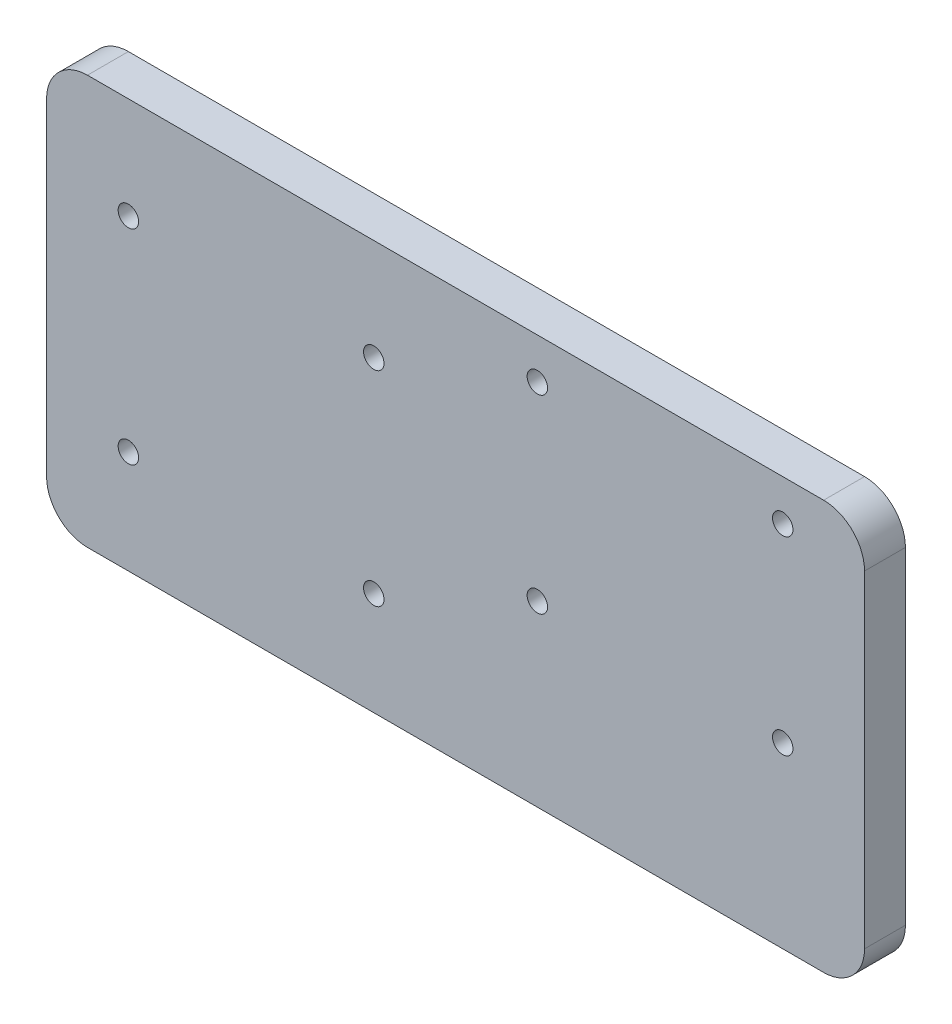
from build123d import *

# Parameters (mm, degrees)
SKETCH4_W                                     = 200
SKETCH4_H                                     = 100
BOSS_EXTRUDE1_DEPTH                           = 10
CBORE_FOR_M6_HEX_HEAD_CAP_SCREW7_D            = 6
CBORE_FOR_M6_HEX_HEAD_CAP_SCREW7_DEPTH        = 8
CBORE_FOR_M6_HEX_HEAD_CAP_SCREW7_CBORE_D      = 8
CBORE_FOR_M6_HEX_HEAD_CAP_SCREW7_CBORE_DEPTH  = 2
CBORE_FOR_M6_HEX_HEAD_CAP_SCREW7_TIP          = 1.802581857
CBORE_FOR_M6_HEX_HEAD_CAP_SCREW8_D            = 6
CBORE_FOR_M6_HEX_HEAD_CAP_SCREW8_DEPTH        = 8
CBORE_FOR_M6_HEX_HEAD_CAP_SCREW8_CBORE_D      = 8
CBORE_FOR_M6_HEX_HEAD_CAP_SCREW8_CBORE_DEPTH  = 2
CBORE_FOR_M6_HEX_HEAD_CAP_SCREW8_TIP          = 1.802581857
CBORE_FOR_M6_HEX_HEAD_CAP_SCREW9_D            = 6
CBORE_FOR_M6_HEX_HEAD_CAP_SCREW9_DEPTH        = 8
CBORE_FOR_M6_HEX_HEAD_CAP_SCREW9_CBORE_D      = 8
CBORE_FOR_M6_HEX_HEAD_CAP_SCREW9_CBORE_DEPTH  = 2
CBORE_FOR_M6_HEX_HEAD_CAP_SCREW9_TIP          = 1.802581857
CBORE_FOR_M6_HEX_HEAD_CAP_SCREW10_D           = 6
CBORE_FOR_M6_HEX_HEAD_CAP_SCREW10_DEPTH       = 8
CBORE_FOR_M6_HEX_HEAD_CAP_SCREW10_CBORE_D     = 8
CBORE_FOR_M6_HEX_HEAD_CAP_SCREW10_CBORE_DEPTH = 2
CBORE_FOR_M6_HEX_HEAD_CAP_SCREW10_TIP         = 1.802581857
F_1_0_1_DIAMETER_HOLE7_D                      = 5
F_1_0_1_DIAMETER_HOLE7_DEPTH                  = 8
F_1_0_1_DIAMETER_HOLE7_TIP                    = 1.502151548
F_1_0_1_DIAMETER_HOLE8_D                      = 5
F_1_0_1_DIAMETER_HOLE8_DEPTH                  = 8
F_1_0_1_DIAMETER_HOLE8_TIP                    = 1.502151548
F_1_0_1_DIAMETER_HOLE9_D                      = 5
F_1_0_1_DIAMETER_HOLE9_DEPTH                  = 8
F_1_0_1_DIAMETER_HOLE9_TIP                    = 1.502151548
F_1_0_1_DIAMETER_HOLE10_D                     = 5
F_1_0_1_DIAMETER_HOLE10_DEPTH                 = 8
F_1_0_1_DIAMETER_HOLE10_TIP                   = 1.502151548
F_5_0_5_DIAMETER_HOLE1_D                      = 5
F_5_0_5_DIAMETER_HOLE1_DEPTH                  = 8
F_5_0_5_DIAMETER_HOLE1_TIP                    = 1.502151548
F_5_0_5_DIAMETER_HOLE2_D                      = 5
F_5_0_5_DIAMETER_HOLE2_DEPTH                  = 8
F_5_0_5_DIAMETER_HOLE2_TIP                    = 1.502151548
F_5_0_5_DIAMETER_HOLE3_D                      = 5
F_5_0_5_DIAMETER_HOLE3_DEPTH                  = 8
F_5_0_5_DIAMETER_HOLE3_TIP                    = 1.502151548
F_5_0_5_DIAMETER_HOLE5_D                      = 5
F_5_0_5_DIAMETER_HOLE5_DEPTH                  = 8
F_5_0_5_DIAMETER_HOLE5_TIP                    = 1.502151548
FILLET1_R                                     = 10
FILLET2_R                                     = 10
FILLET3_R                                     = 10
FILLET4_R                                     = 10
SCALE2_SCALE                                  = 1.5
SCALE6_SCALE                                  = 0.935
SCALE7_SCALE                                  = 0.9


with BuildPart() as part:
    # Sketch4 → Boss-Extrude1 (new body)
    with BuildSketch(Plane.XY):
        with Locations((100, 50)):
            Rectangle(SKETCH4_W, SKETCH4_H)
    extrude(amount=BOSS_EXTRUDE1_DEPTH)

    # CBORE for M6 Hex Head Cap Screw7
    with Locations(Plane(origin=(0, 0, 0), x_dir=(-1, 0, 0), z_dir=(0, 0, -1))):
        with Locations((-80, 83.464013217)):
            CounterBoreHole(CBORE_FOR_M6_HEX_HEAD_CAP_SCREW7_D / 2, CBORE_FOR_M6_HEX_HEAD_CAP_SCREW7_CBORE_D / 2, CBORE_FOR_M6_HEX_HEAD_CAP_SCREW7_CBORE_DEPTH, depth=CBORE_FOR_M6_HEX_HEAD_CAP_SCREW7_DEPTH)
            with Locations((0, 0, -(CBORE_FOR_M6_HEX_HEAD_CAP_SCREW7_DEPTH + CBORE_FOR_M6_HEX_HEAD_CAP_SCREW7_TIP / 2))):  # 118° drill point
                Cone(0, CBORE_FOR_M6_HEX_HEAD_CAP_SCREW7_D / 2, CBORE_FOR_M6_HEX_HEAD_CAP_SCREW7_TIP, mode=Mode.SUBTRACT)

    # CBORE for M6 Hex Head Cap Screw8
    with Locations(Plane(origin=(0, 0, 0), x_dir=(-1, 0, 0), z_dir=(0, 0, -1))):
        with Locations((-20, 83.464013217)):
            CounterBoreHole(CBORE_FOR_M6_HEX_HEAD_CAP_SCREW8_D / 2, CBORE_FOR_M6_HEX_HEAD_CAP_SCREW8_CBORE_D / 2, CBORE_FOR_M6_HEX_HEAD_CAP_SCREW8_CBORE_DEPTH, depth=CBORE_FOR_M6_HEX_HEAD_CAP_SCREW8_DEPTH)
            with Locations((0, 0, -(CBORE_FOR_M6_HEX_HEAD_CAP_SCREW8_DEPTH + CBORE_FOR_M6_HEX_HEAD_CAP_SCREW8_TIP / 2))):  # 118° drill point
                Cone(0, CBORE_FOR_M6_HEX_HEAD_CAP_SCREW8_D / 2, CBORE_FOR_M6_HEX_HEAD_CAP_SCREW8_TIP, mode=Mode.SUBTRACT)

    # CBORE for M6 Hex Head Cap Screw9
    with Locations(Plane(origin=(0, 0, 0), x_dir=(-1, 0, 0), z_dir=(0, 0, -1))):
        with Locations((-20, 16.814013217)):
            CounterBoreHole(CBORE_FOR_M6_HEX_HEAD_CAP_SCREW9_D / 2, CBORE_FOR_M6_HEX_HEAD_CAP_SCREW9_CBORE_D / 2, CBORE_FOR_M6_HEX_HEAD_CAP_SCREW9_CBORE_DEPTH, depth=CBORE_FOR_M6_HEX_HEAD_CAP_SCREW9_DEPTH)
            with Locations((0, 0, -(CBORE_FOR_M6_HEX_HEAD_CAP_SCREW9_DEPTH + CBORE_FOR_M6_HEX_HEAD_CAP_SCREW9_TIP / 2))):  # 118° drill point
                Cone(0, CBORE_FOR_M6_HEX_HEAD_CAP_SCREW9_D / 2, CBORE_FOR_M6_HEX_HEAD_CAP_SCREW9_TIP, mode=Mode.SUBTRACT)

    # CBORE for M6 Hex Head Cap Screw10
    with Locations(Plane(origin=(0, 0, 0), x_dir=(-1, 0, 0), z_dir=(0, 0, -1))):
        with Locations((-80, 16.814013217)):
            CounterBoreHole(CBORE_FOR_M6_HEX_HEAD_CAP_SCREW10_D / 2, CBORE_FOR_M6_HEX_HEAD_CAP_SCREW10_CBORE_D / 2, CBORE_FOR_M6_HEX_HEAD_CAP_SCREW10_CBORE_DEPTH, depth=CBORE_FOR_M6_HEX_HEAD_CAP_SCREW10_DEPTH)
            with Locations((0, 0, -(CBORE_FOR_M6_HEX_HEAD_CAP_SCREW10_DEPTH + CBORE_FOR_M6_HEX_HEAD_CAP_SCREW10_TIP / 2))):  # 118° drill point
                Cone(0, CBORE_FOR_M6_HEX_HEAD_CAP_SCREW10_D / 2, CBORE_FOR_M6_HEX_HEAD_CAP_SCREW10_TIP, mode=Mode.SUBTRACT)

    # Ø1.0 (1) Diameter Hole7
    with Locations(Plane.XY.offset(10)):
        with Locations((20, 75.196019825)):
            Hole(F_1_0_1_DIAMETER_HOLE7_D / 2, depth=F_1_0_1_DIAMETER_HOLE7_DEPTH)
            with Locations((0, 0, -(F_1_0_1_DIAMETER_HOLE7_DEPTH + F_1_0_1_DIAMETER_HOLE7_TIP / 2))):  # 118° drill point
                Cone(0, F_1_0_1_DIAMETER_HOLE7_D / 2, F_1_0_1_DIAMETER_HOLE7_TIP, mode=Mode.SUBTRACT)

    # Ø1.0 (1) Diameter Hole8
    with Locations(Plane.XY.offset(10)):
        with Locations((80, 75.196019825)):
            Hole(F_1_0_1_DIAMETER_HOLE8_D / 2, depth=F_1_0_1_DIAMETER_HOLE8_DEPTH)
            with Locations((0, 0, -(F_1_0_1_DIAMETER_HOLE8_DEPTH + F_1_0_1_DIAMETER_HOLE8_TIP / 2))):  # 118° drill point
                Cone(0, F_1_0_1_DIAMETER_HOLE8_D / 2, F_1_0_1_DIAMETER_HOLE8_TIP, mode=Mode.SUBTRACT)

    # Ø1.0 (1) Diameter Hole9
    with Locations(Plane.XY.offset(10)):
        with Locations((20, 25.221019825)):
            Hole(F_1_0_1_DIAMETER_HOLE9_D / 2, depth=F_1_0_1_DIAMETER_HOLE9_DEPTH)
            with Locations((0, 0, -(F_1_0_1_DIAMETER_HOLE9_DEPTH + F_1_0_1_DIAMETER_HOLE9_TIP / 2))):  # 118° drill point
                Cone(0, F_1_0_1_DIAMETER_HOLE9_D / 2, F_1_0_1_DIAMETER_HOLE9_TIP, mode=Mode.SUBTRACT)

    # Ø1.0 (1) Diameter Hole10
    with Locations(Plane.XY.offset(10)):
        with Locations((80, 25.221019825)):
            Hole(F_1_0_1_DIAMETER_HOLE10_D / 2, depth=F_1_0_1_DIAMETER_HOLE10_DEPTH)
            with Locations((0, 0, -(F_1_0_1_DIAMETER_HOLE10_DEPTH + F_1_0_1_DIAMETER_HOLE10_TIP / 2))):  # 118° drill point
                Cone(0, F_1_0_1_DIAMETER_HOLE10_D / 2, F_1_0_1_DIAMETER_HOLE10_TIP, mode=Mode.SUBTRACT)

    # Ø5.0 (5) Diameter Hole1
    with Locations(Plane.XY.offset(10)):
        with Locations((120, 90)):
            Hole(F_5_0_5_DIAMETER_HOLE1_D / 2, depth=F_5_0_5_DIAMETER_HOLE1_DEPTH)
            with Locations((0, 0, -(F_5_0_5_DIAMETER_HOLE1_DEPTH + F_5_0_5_DIAMETER_HOLE1_TIP / 2))):  # 118° drill point
                Cone(0, F_5_0_5_DIAMETER_HOLE1_D / 2, F_5_0_5_DIAMETER_HOLE1_TIP, mode=Mode.SUBTRACT)

    # Ø5.0 (5) Diameter Hole2
    with Locations(Plane.XY.offset(10)):
        with Locations((180, 90)):
            Hole(F_5_0_5_DIAMETER_HOLE2_D / 2, depth=F_5_0_5_DIAMETER_HOLE2_DEPTH)
            with Locations((0, 0, -(F_5_0_5_DIAMETER_HOLE2_DEPTH + F_5_0_5_DIAMETER_HOLE2_TIP / 2))):  # 118° drill point
                Cone(0, F_5_0_5_DIAMETER_HOLE2_D / 2, F_5_0_5_DIAMETER_HOLE2_TIP, mode=Mode.SUBTRACT)

    # Ø5.0 (5) Diameter Hole3
    with Locations(Plane.XY.offset(10)):
        with Locations((120, 43.628026433)):
            Hole(F_5_0_5_DIAMETER_HOLE3_D / 2, depth=F_5_0_5_DIAMETER_HOLE3_DEPTH)
            with Locations((0, 0, -(F_5_0_5_DIAMETER_HOLE3_DEPTH + F_5_0_5_DIAMETER_HOLE3_TIP / 2))):  # 118° drill point
                Cone(0, F_5_0_5_DIAMETER_HOLE3_D / 2, F_5_0_5_DIAMETER_HOLE3_TIP, mode=Mode.SUBTRACT)

    # Ø5.0 (5) Diameter Hole5
    with Locations(Plane.XY.offset(10)):
        with Locations((180, 43.628026433)):
            Hole(F_5_0_5_DIAMETER_HOLE5_D / 2, depth=F_5_0_5_DIAMETER_HOLE5_DEPTH)
            with Locations((0, 0, -(F_5_0_5_DIAMETER_HOLE5_DEPTH + F_5_0_5_DIAMETER_HOLE5_TIP / 2))):  # 118° drill point
                Cone(0, F_5_0_5_DIAMETER_HOLE5_D / 2, F_5_0_5_DIAMETER_HOLE5_TIP, mode=Mode.SUBTRACT)

    # Fillet1
    fillet1_edges = [part.edges().sort_by_distance(p)[0] for p in [
        (0, 100, 5),
    ]]
    fillet(fillet1_edges, radius=FILLET1_R)

    # Fillet2
    fillet2_edges = [part.edges().sort_by_distance(p)[0] for p in [
        (0, 0, 5),
    ]]
    fillet(fillet2_edges, radius=FILLET2_R)

    # Fillet3
    fillet3_edges = [part.edges().sort_by_distance(p)[0] for p in [
        (200, 0, 5),
    ]]
    fillet(fillet3_edges, radius=FILLET3_R)

    # Fillet4
    fillet4_edges = [part.edges().sort_by_distance(p)[0] for p in [
        (200, 100, 5),
    ]]
    fillet(fillet4_edges, radius=FILLET4_R)


with BuildPart() as part_1:
    # Scale2: scaled about (100.292046526, 49.941397219, 5.001946843)
    add(part.part.scale(SCALE2_SCALE).moved(Location((-50.146023263, -24.97069861, -2.500973421))))


with BuildPart() as part_2:
    # Scale6: scaled about (100.292046526, 49.941397219, 5.001946844)
    add(part_1.part.scale(SCALE6_SCALE).moved(Location((6.518983024, 3.246190819, 0.325126545))))


with BuildPart() as part_3:
    # Scale7: scaled about (100.292046526, 49.941397219, 5.001946844)
    add(part_2.part.scale(SCALE7_SCALE).moved(Location((10.029204653, 4.994139722, 0.500194684))))


solid = part_3.part
